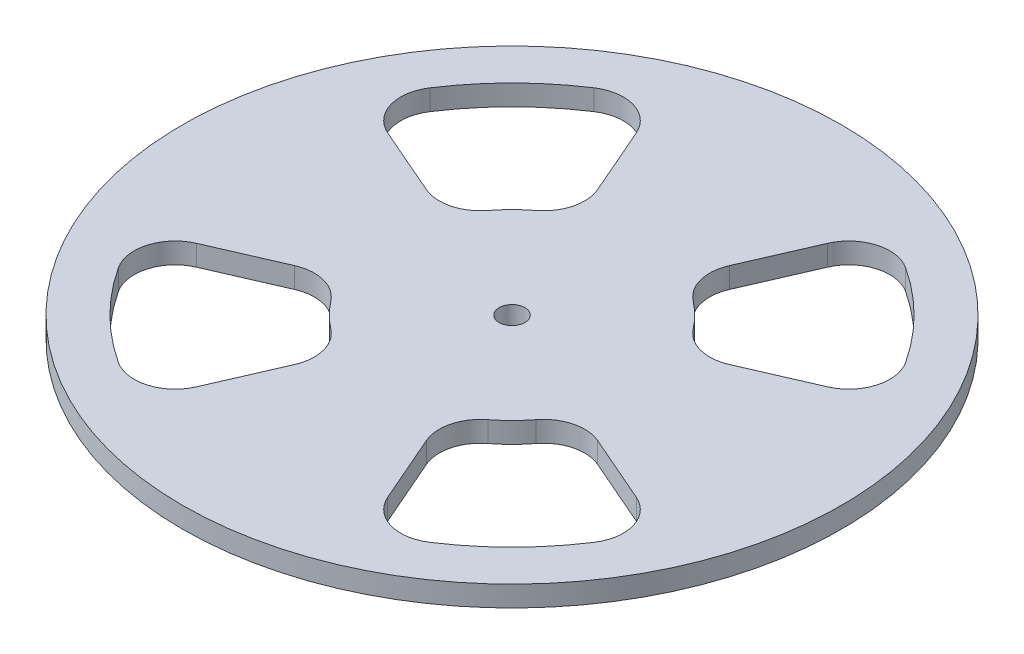
from build123d import *

# Parameters (mm, degrees)
SKETCH1_R           = 25.5
SKETCH1_R_2         = 1
BOSS_EXTRUDE1_DEPTH = 1.6
CUT_EXTRUDE1_REACH  = 38.098


with BuildPart() as part:
    # Sketch1 → Boss-Extrude1 (new body)
    with BuildSketch(Plane(origin=(0, 0, 0), x_dir=(1, 0, 0), z_dir=(0, 1, 0))):
        Circle(SKETCH1_R)
        Circle(SKETCH1_R_2, mode=Mode.SUBTRACT)
    extrude(amount=BOSS_EXTRUDE1_DEPTH)

    # Sketch2 → Cut-Extrude1 (cut, up to next)
    with BuildSketch(Plane(origin=(0, 1.6, 0), x_dir=(1, 0, 0), z_dir=(0, 1, 0)), mode=Mode.PRIVATE) as cut_extrude1_sk1:
        with BuildLine():
            Line((5.098689446, 11.726182923), (7.398917645, 17.016345603))
            ThreePointArc((7.398917645, 17.016345603), (9.401129193, 18.792276888), (12.049552955, 18.406745328))
            ThreePointArc((12.049552955, 18.406745328), (15.556349186, 15.556349186), (18.406745328, 12.049552955))
            ThreePointArc((18.406745328, 12.049552955), (18.792276888, 9.401129193), (17.016345603, 7.398917645))
            Line((17.016345603, 7.398917645), (11.726182923, 5.098689446))
            ThreePointArc((11.726182923, 5.098689446), (9.663717077, 4.936869827), (7.939396303, 6.079965983))
            ThreePointArc((7.939396303, 6.079965983), (7.071067812, 7.071067812), (6.079965983, 7.939396303))
            ThreePointArc((6.079965983, 7.939396303), (4.936869827, 9.663717077), (5.098689446, 11.726182923))
        make_face()
    cut_extrude1_tool1 = extrude(cut_extrude1_sk1.sketch, amount=-CUT_EXTRUDE1_REACH, mode=Mode.PRIVATE) & part.part
    # Sketch2 → Cut-Extrude1 (cut, up to next)
    with BuildSketch(Plane(origin=(0, 1.6, 0), x_dir=(1, 0, 0), z_dir=(0, 1, 0)), mode=Mode.PRIVATE) as cut_extrude1_sk2:
        with BuildLine():
            Line((-11.726182923, 5.098689446), (-17.016345603, 7.398917645))
            ThreePointArc((-17.016345603, 7.398917645), (-18.792276888, 9.401129193), (-18.406745328, 12.049552955))
            ThreePointArc((-18.406745328, 12.049552955), (-15.556349186, 15.556349186), (-12.049552955, 18.406745328))
            ThreePointArc((-12.049552955, 18.406745328), (-9.401129193, 18.792276888), (-7.398917645, 17.016345603))
            Line((-7.398917645, 17.016345603), (-5.098689446, 11.726182923))
            ThreePointArc((-5.098689446, 11.726182923), (-4.936869827, 9.663717077), (-6.079965983, 7.939396303))
            ThreePointArc((-6.079965983, 7.939396303), (-7.071067812, 7.071067812), (-7.939396303, 6.079965983))
            ThreePointArc((-7.939396303, 6.079965983), (-9.663717077, 4.936869827), (-11.726182923, 5.098689446))
        make_face()
    cut_extrude1_tool2 = extrude(cut_extrude1_sk2.sketch, amount=-CUT_EXTRUDE1_REACH, mode=Mode.PRIVATE) & part.part
    # Sketch2 → Cut-Extrude1 (cut, up to next)
    with BuildSketch(Plane(origin=(0, 1.6, 0), x_dir=(1, 0, 0), z_dir=(0, 1, 0)), mode=Mode.PRIVATE) as cut_extrude1_sk3:
        with BuildLine():
            Line((-11.726182923, -5.098689446), (-17.016345603, -7.398917645))
            ThreePointArc((-17.016345603, -7.398917645), (-18.792276888, -9.401129193), (-18.406745328, -12.049552955))
            ThreePointArc((-18.406745328, -12.049552955), (-15.556349186, -15.556349186), (-12.049552955, -18.406745328))
            ThreePointArc((-12.049552955, -18.406745328), (-9.401129193, -18.792276888), (-7.398917645, -17.016345603))
            Line((-7.398917645, -17.016345603), (-5.098689446, -11.726182923))
            ThreePointArc((-5.098689446, -11.726182923), (-4.936869827, -9.663717077), (-6.079965983, -7.939396303))
            ThreePointArc((-6.079965983, -7.939396303), (-7.071067812, -7.071067812), (-7.939396303, -6.079965983))
            ThreePointArc((-7.939396303, -6.079965983), (-9.663717077, -4.936869827), (-11.726182923, -5.098689446))
        make_face()
    cut_extrude1_tool3 = extrude(cut_extrude1_sk3.sketch, amount=-CUT_EXTRUDE1_REACH, mode=Mode.PRIVATE) & part.part
    # Sketch2 → Cut-Extrude1 (cut, up to next)
    with BuildSketch(Plane(origin=(0, 1.6, 0), x_dir=(1, 0, 0), z_dir=(0, 1, 0)), mode=Mode.PRIVATE) as cut_extrude1_sk4:
        with BuildLine():
            Line((11.726182923, -5.098689446), (17.016345603, -7.398917645))
            ThreePointArc((17.016345603, -7.398917645), (18.792276888, -9.401129193), (18.406745328, -12.049552955))
            ThreePointArc((18.406745328, -12.049552955), (15.556349186, -15.556349186), (12.049552955, -18.406745328))
            ThreePointArc((12.049552955, -18.406745328), (9.401129193, -18.792276888), (7.398917645, -17.016345603))
            Line((7.398917645, -17.016345603), (5.098689446, -11.726182923))
            ThreePointArc((5.098689446, -11.726182923), (4.936869827, -9.663717077), (6.079965983, -7.939396303))
            ThreePointArc((6.079965983, -7.939396303), (7.071067812, -7.071067812), (7.939396303, -6.079965983))
            ThreePointArc((7.939396303, -6.079965983), (9.663717077, -4.936869827), (11.726182923, -5.098689446))
        make_face()
    cut_extrude1_tool4 = extrude(cut_extrude1_sk4.sketch, amount=-CUT_EXTRUDE1_REACH, mode=Mode.PRIVATE) & part.part
    add(cut_extrude1_tool1.solids().sort_by_distance((11.555905, 1.6, -11.555905))[0], mode=Mode.SUBTRACT)
    add(cut_extrude1_tool2.solids().sort_by_distance((-11.555905, 1.6, -11.555905))[0], mode=Mode.SUBTRACT)
    add(cut_extrude1_tool3.solids().sort_by_distance((-11.555905, 1.6, 11.555905))[0], mode=Mode.SUBTRACT)
    add(cut_extrude1_tool4.solids().sort_by_distance((11.555905, 1.6, 11.555905))[0], mode=Mode.SUBTRACT)


solid = part.part
